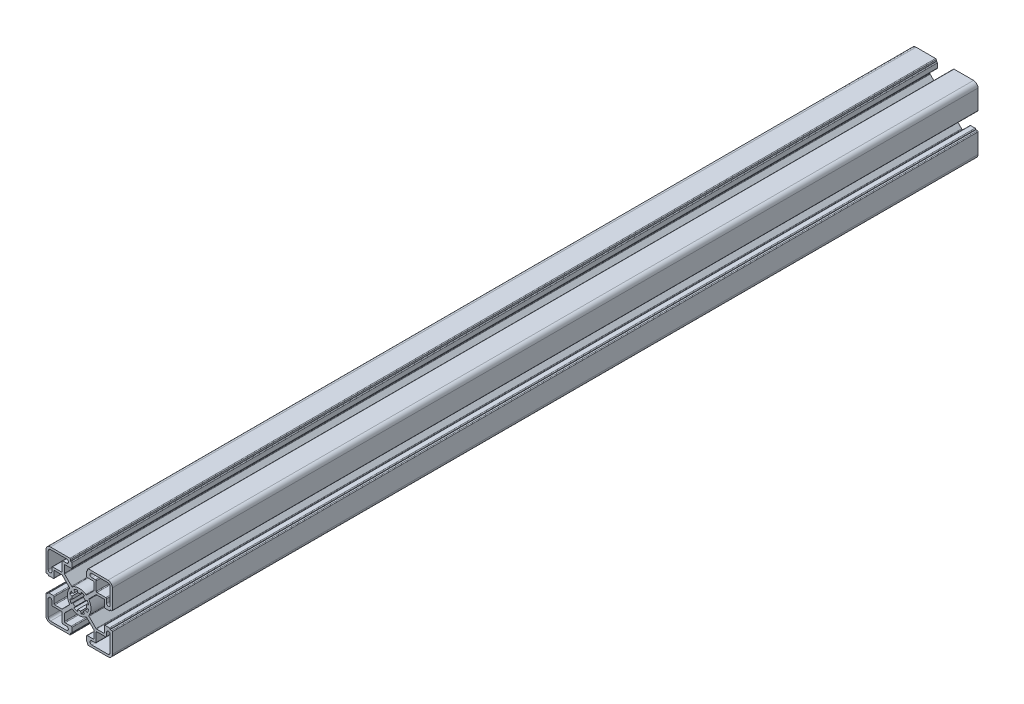
from build123d import *

# Parameters (mm, degrees)
BOSS_EXTRUDE1_DEPTH      = 152.4
BOSS_EXTRUDE1_DEPTH_BACK = 152.4
SKETCH3_R                = 5
FILLET1_R                = 0.5
CUT_EXTRUDE1_DEPTH       = 307.456424309
BOSS_EXTRUDE2_DEPTH      = 282.1


with BuildPart() as part:
    # Sketch3 → Boss-Extrude1 (new, two sides: drawn at the far end of the back side and taken through both)
    with BuildSketch(Plane.XY.offset(-BOSS_EXTRUDE1_DEPTH_BACK)):
        with BuildLine():
            Line((-11.55, -10.05), (-6.356915373, -4.856915373))
            ThreePointArc((-6.356915373, -4.856915373), (-8, 0), (-6.356915373, 4.856915373))
            Line((-6.356915373, 4.856915373), (-11.55, 10.05))
            Line((-11.55, 10.05), (-17.025, 10.05))
            Line((-17.025, 10.05), (-17.025, 5))
            Line((-17.025, 5), (-21, 5))
            Line((-21, 5), (-21, 5.8))
            Line((-21, 5.8), (-22.5, 5.8))
            Line((-22.5, 5.8), (-22.5, 19.5))
            ThreePointArc((-22.5, 19.5), (-21.621320344, 21.621320344), (-19.5, 22.5))
            Line((-19.5, 22.5), (-5.8, 22.5))
            Line((-5.8, 22.5), (-5.8, 21))
            Line((-5.8, 21), (-5, 21))
            Line((-5, 21), (-5, 17.025))
            Line((-5, 17.025), (-10.05, 17.025))
            Line((-10.05, 17.025), (-10.05, 11.55))
            Line((-10.05, 11.55), (-4.856915373, 6.356915373))
            ThreePointArc((-4.856915373, 6.356915373), (0, 8), (4.856915373, 6.356915373))
            Line((4.856915373, 6.356915373), (10.05, 11.55))
            Line((10.05, 11.55), (10.05, 17.025))
            Line((10.05, 17.025), (5, 17.025))
            Line((5, 17.025), (5, 21))
            Line((5, 21), (5.8, 21))
            Line((5.8, 21), (5.8, 22.5))
            Line((5.8, 22.5), (19.5, 22.5))
            ThreePointArc((19.5, 22.5), (21.621320344, 21.621320344), (22.5, 19.5))
            Line((22.5, 19.5), (22.5, 5.8))
            Line((22.5, 5.8), (21, 5.8))
            Line((21, 5.8), (21, 5))
            Line((21, 5), (17.025, 5))
            Line((17.025, 5), (17.025, 10.05))
            Line((17.025, 10.05), (11.55, 10.05))
            Line((11.55, 10.05), (6.356915373, 4.856915373))
            ThreePointArc((6.356915373, 4.856915373), (8, 0), (6.356915373, -4.856915373))
            Line((6.356915373, -4.856915373), (11.55, -10.05))
            Line((11.55, -10.05), (17.025, -10.05))
            Line((17.025, -10.05), (17.025, -5))
            Line((17.025, -5), (21, -5))
            Line((21, -5), (21, -5.8))
            Line((21, -5.8), (22.5, -5.8))
            Line((22.5, -5.8), (22.5, -19.5))
            ThreePointArc((22.5, -19.5), (21.621320344, -21.621320344), (19.5, -22.5))
            Line((19.5, -22.5), (5.8, -22.5))
            Line((5.8, -22.5), (5.8, -21))
            Line((5.8, -21), (5, -21))
            Line((5, -21), (5, -17.025))
            Line((5, -17.025), (10.05, -17.025))
            Line((10.05, -17.025), (10.05, -11.55))
            Line((10.05, -11.55), (4.856915373, -6.356915373))
            ThreePointArc((4.856915373, -6.356915373), (0, -8), (-4.856915373, -6.356915373))
            Line((-4.856915373, -6.356915373), (-10.05, -11.55))
            Line((-10.05, -11.55), (-10.05, -17.025))
            Line((-10.05, -17.025), (-5, -17.025))
            Line((-5, -17.025), (-5, -21))
            Line((-5, -21), (-5.8, -21))
            Line((-5.8, -21), (-5.8, -22.5))
            Line((-5.8, -22.5), (-19.5, -22.5))
            ThreePointArc((-19.5, -22.5), (-21.621320344, -21.621320344), (-22.5, -19.5))
            Line((-22.5, -19.5), (-22.5, -5.8))
            Line((-22.5, -5.8), (-21, -5.8))
            Line((-21, -5.8), (-21, -5))
            Line((-21, -5), (-17.025, -5))
            Line((-17.025, -5), (-17.025, -10.05))
            Line((-17.025, -10.05), (-11.55, -10.05))
        make_face()
        with Locations(Location((0, 0, 0), (0, 0, 180))):
            Circle(SKETCH3_R, mode=Mode.SUBTRACT)
        with BuildLine():
            Line((-21, 8.5375), (-21, 19.5))
            ThreePointArc((-21, 19.5), (-20.560660172, 20.560660172), (-19.5, 21))
            Line((-19.5, 21), (-8.5375, 21))
            ThreePointArc((-8.5375, 21), (-7.3, 19.7625), (-8.5375, 18.525))
            Line((-8.5375, 18.525), (-11.55, 18.525))
            Line((-11.55, 18.525), (-11.55, 11.55))
            Line((-11.55, 11.55), (-18.525, 11.55))
            Line((-18.525, 11.55), (-18.525, 8.5375))
            ThreePointArc((-18.525, 8.5375), (-19.7625, 7.3), (-21, 8.5375))
        make_face(mode=Mode.SUBTRACT)
        with BuildLine():
            Line((8.5375, 21), (19.5, 21))
            ThreePointArc((19.5, 21), (20.560660172, 20.560660172), (21, 19.5))
            Line((21, 19.5), (21, 8.5375))
            ThreePointArc((21, 8.5375), (19.7625, 7.3), (18.525, 8.5375))
            Line((18.525, 8.5375), (18.525, 11.55))
            Line((18.525, 11.55), (11.55, 11.55))
            Line((11.55, 11.55), (11.55, 18.525))
            Line((11.55, 18.525), (8.5375, 18.525))
            ThreePointArc((8.5375, 18.525), (7.3, 19.7625), (8.5375, 21))
        make_face(mode=Mode.SUBTRACT)
        with BuildLine():
            Line((21, -8.5375), (21, -19.5))
            ThreePointArc((21, -19.5), (20.560660172, -20.560660172), (19.5, -21))
            Line((19.5, -21), (8.5375, -21))
            ThreePointArc((8.5375, -21), (7.3, -19.7625), (8.5375, -18.525))
            Line((8.5375, -18.525), (11.55, -18.525))
            Line((11.55, -18.525), (11.55, -11.55))
            Line((11.55, -11.55), (18.525, -11.55))
            Line((18.525, -11.55), (18.525, -8.5375))
            ThreePointArc((18.525, -8.5375), (19.7625, -7.3), (21, -8.5375))
        make_face(mode=Mode.SUBTRACT)
        with BuildLine():
            Line((-8.5375, -21), (-19.5, -21))
            ThreePointArc((-19.5, -21), (-20.560660172, -20.560660172), (-21, -19.5))
            Line((-21, -19.5), (-21, -8.5375))
            ThreePointArc((-21, -8.5375), (-19.7625, -7.3), (-18.525, -8.5375))
            Line((-18.525, -8.5375), (-18.525, -11.55))
            Line((-18.525, -11.55), (-11.55, -11.55))
            Line((-11.55, -11.55), (-11.55, -18.525))
            Line((-11.55, -18.525), (-8.5375, -18.525))
            ThreePointArc((-8.5375, -18.525), (-7.3, -19.7625), (-8.5375, -21))
        make_face(mode=Mode.SUBTRACT)
    extrude(amount=BOSS_EXTRUDE1_DEPTH + BOSS_EXTRUDE1_DEPTH_BACK)

    # Fillet1
    fillet1_edges = [part.edges().sort_by_distance(p)[0] for p in [
        (-11.55, -18.525, 0),
        (-11.55, -11.55, 0),
        (18.525, -11.55, 0),
        (11.55, -11.55, 0),
        (11.55, -18.525, 0),
        (11.55, 18.525, 0),
        (11.55, 11.55, 0),
        (18.525, 11.55, 0),
        (-18.525, 11.55, 0),
        (-11.55, 11.55, 0),
        (-11.55, 18.525, 0),
        (6.356915373, -4.856915373, 0),
        (11.55, -10.05, 0),
        (17.025, -10.05, 0),
        (17.025, -5, 0),
        (21, -5, 0),
        (22.5, -5.8, 0),
        (5.8, -22.5, 0),
        (5, -21, 0),
        (5, -17.025, 0),
        (10.05, -17.025, 0),
        (10.05, -11.55, 0),
        (4.856915373, -6.356915373, 0),
        (-4.856915373, -6.356915373, 0),
        (-10.05, -11.55, 0),
        (-10.05, -17.025, 0),
        (-5, -17.025, 0),
        (-5, -21, 0),
        (-5.8, -22.5, 0),
        (-22.5, -5.8, 0),
        (-21, -5, 0),
        (-17.025, -5, 0),
        (-17.025, -10.05, 0),
        (-11.55, -10.05, 0),
        (-6.356915373, -4.856915373, 0),
        (-6.356915373, 4.856915373, 0),
        (-11.55, 10.05, 0),
        (-17.025, 10.05, 0),
        (-17.025, 5, 0),
        (-21, 5, 0),
        (-22.5, 5.8, 0),
        (-5.8, 22.5, 0),
        (-5, 21, 0),
        (-5, 17.025, 0),
        (-10.05, 17.025, 0),
        (-10.05, 11.55, 0),
        (-4.856915373, 6.356915373, 0),
        (4.856915373, 6.356915373, 0),
        (10.05, 11.55, 0),
        (10.05, 17.025, 0),
        (5, 17.025, 0),
        (5, 21, 0),
        (5.8, 22.5, 0),
        (22.5, 5.8, 0),
        (21, 5, 0),
        (17.025, 5, 0),
        (11.55, 10.05, 0),
        (6.356915373, 4.856915373, 0),
    ]]
    fillet(fillet1_edges, radius=FILLET1_R)

    # Sketch4 → Cut-Extrude1 (cut, through all)
    with BuildSketch(Plane.XY.offset(152.4)):
        with BuildLine():
            Line((-1.268087093, 6.375104323), (-0.97545161, 4.903926402))
            ThreePointArc((-0.97545161, 4.903926402), (-1.913417162, 4.619397663), (-2.777851165, 4.157348062))
            Line((-2.777851165, 4.157348062), (-3.611206515, 5.40455248))
            ThreePointArc((-3.611206515, 5.40455248), (-2.48744231, 6.005216961), (-1.268087093, 6.375104323))
        make_face()
        with BuildLine():
            Line((1.268087093, 6.375104323), (0.97545161, 4.903926402))
            ThreePointArc((0.97545161, 4.903926402), (1.913417162, 4.619397663), (2.777851165, 4.157348062))
            Line((2.777851165, 4.157348062), (3.611206515, 5.40455248))
            ThreePointArc((3.611206515, 5.40455248), (2.48744231, 6.005216961), (1.268087093, 6.375104323))
        make_face()
        with BuildLine():
            Line((5.40455248, 3.611206515), (4.157348062, 2.777851165))
            ThreePointArc((4.157348062, 2.777851165), (4.619397663, 1.913417162), (4.903926402, 0.97545161))
            Line((4.903926402, 0.97545161), (6.375104323, 1.268087093))
            ThreePointArc((6.375104323, 1.268087093), (6.005216961, 2.48744231), (5.40455248, 3.611206515))
        make_face()
        with BuildLine():
            Line((6.375104323, -1.268087093), (4.903926402, -0.97545161))
            ThreePointArc((4.903926402, -0.97545161), (4.619397663, -1.913417162), (4.157348062, -2.777851165))
            Line((4.157348062, -2.777851165), (5.40455248, -3.611206515))
            ThreePointArc((5.40455248, -3.611206515), (6.005216961, -2.48744231), (6.375104323, -1.268087093))
        make_face()
        with BuildLine():
            Line((3.611206515, -5.40455248), (2.777851165, -4.157348062))
            ThreePointArc((2.777851165, -4.157348062), (1.913417162, -4.619397663), (0.97545161, -4.903926402))
            Line((0.97545161, -4.903926402), (1.268087093, -6.375104323))
            ThreePointArc((1.268087093, -6.375104323), (2.48744231, -6.005216961), (3.611206515, -5.40455248))
        make_face()
        with BuildLine():
            Line((-1.268087093, -6.375104323), (-0.97545161, -4.903926402))
            ThreePointArc((-0.97545161, -4.903926402), (-1.913417162, -4.619397663), (-2.777851165, -4.157348062))
            Line((-2.777851165, -4.157348062), (-3.611206515, -5.40455248))
            ThreePointArc((-3.611206515, -5.40455248), (-2.48744231, -6.005216961), (-1.268087093, -6.375104323))
        make_face()
        with BuildLine():
            Line((-5.40455248, -3.611206515), (-4.157348062, -2.777851165))
            ThreePointArc((-4.157348062, -2.777851165), (-4.619397663, -1.913417162), (-4.903926402, -0.97545161))
            Line((-4.903926402, -0.97545161), (-6.375104323, -1.268087093))
            ThreePointArc((-6.375104323, -1.268087093), (-6.005216961, -2.48744231), (-5.40455248, -3.611206515))
        make_face()
        with BuildLine():
            Line((-6.375104323, 1.268087093), (-4.903926402, 0.97545161))
            ThreePointArc((-4.903926402, 0.97545161), (-4.619397663, 1.913417162), (-4.157348062, 2.777851165))
            Line((-4.157348062, 2.777851165), (-5.40455248, 3.611206515))
            ThreePointArc((-5.40455248, 3.611206515), (-6.005216961, 2.48744231), (-6.375104323, 1.268087093))
        make_face()
    extrude(amount=-CUT_EXTRUDE1_DEPTH, mode=Mode.SUBTRACT)

    # Sketch6 → Boss-Extrude2 (add)
    with BuildSketch(Plane.XY.offset(152.4)):
        with BuildLine():
            Line((22.5, -19.5), (22.5, -6.3))
            ThreePointArc((22.5, -6.3), (22.353553391, -5.946446609), (22, -5.8))
            Line((22, -5.8), (21, -5.8))
            Line((21, -5.8), (21, -5.5))
            ThreePointArc((21, -5.5), (20.853553391, -5.146446609), (20.5, -5))
            Line((20.5, -5), (17.525, -5))
            ThreePointArc((17.525, -5), (17.171446609, -5.146446609), (17.025, -5.5))
            Line((17.025, -5.5), (17.025, -9.55))
            ThreePointArc((17.025, -9.55), (16.878553391, -9.903553391), (16.525, -10.05))
            Line((16.525, -10.05), (11.757106781, -10.05))
            ThreePointArc((11.757106781, -10.05), (11.565765065, -10.011939766), (11.403553391, -9.903553391))
            Line((11.403553391, -9.903553391), (6.658229, -5.158229))
            ThreePointArc((6.658229, -5.158229), (6.513911961, -4.850773717), (6.599324603, -4.522047632))
            ThreePointArc((6.599324603, -4.522047632), (8, 0), (6.599324603, 4.522047632))
            ThreePointArc((6.599324603, 4.522047632), (6.513911961, 4.850773717), (6.658229, 5.158229))
            Line((6.658229, 5.158229), (11.403553391, 9.903553391))
            ThreePointArc((11.403553391, 9.903553391), (11.565765065, 10.011939766), (11.757106781, 10.05))
            Line((11.757106781, 10.05), (17.025, 10.05))
            Line((17.025, 10.05), (17.025, 5.5))
            ThreePointArc((17.025, 5.5), (17.171446609, 5.146446609), (17.525, 5))
            Line((17.525, 5), (20.5, 5))
            ThreePointArc((20.5, 5), (20.853553391, 5.146446609), (21, 5.5))
            Line((21, 5.5), (21, 5.8))
            Line((21, 5.8), (22, 5.8))
            ThreePointArc((22, 5.8), (22.353553391, 5.946446609), (22.5, 6.3))
            Line((22.5, 6.3), (22.5, 19.5))
            ThreePointArc((22.5, 19.5), (21.621320344, 21.621320344), (19.5, 22.5))
            Line((19.5, 22.5), (6.3, 22.5))
            ThreePointArc((6.3, 22.5), (5.946446609, 22.353553391), (5.8, 22))
            Line((5.8, 22), (5.8, 21))
            Line((5.8, 21), (5.5, 21))
            ThreePointArc((5.5, 21), (5.146446609, 20.853553391), (5, 20.5))
            Line((5, 20.5), (5, 17.525))
            ThreePointArc((5, 17.525), (5.146446609, 17.171446609), (5.5, 17.025))
            Line((5.5, 17.025), (9.55, 17.025))
            ThreePointArc((9.55, 17.025), (9.903553391, 16.878553391), (10.05, 16.525))
            Line((10.05, 16.525), (10.05, 11.757106781))
            ThreePointArc((10.05, 11.757106781), (10.011939766, 11.565765065), (9.903553391, 11.403553391))
            Line((9.903553391, 11.403553391), (5.158229, 6.658229))
            ThreePointArc((5.158229, 6.658229), (4.850773717, 6.513911961), (4.522047632, 6.599324603))
            ThreePointArc((4.522047632, 6.599324603), (0, 8), (-4.522047632, 6.599324603))
            ThreePointArc((-4.522047632, 6.599324603), (-4.850773717, 6.513911961), (-5.158229, 6.658229))
            Line((-5.158229, 6.658229), (-9.903553391, 11.403553391))
            ThreePointArc((-9.903553391, 11.403553391), (-10.011939766, 11.565765065), (-10.05, 11.757106781))
            Line((-10.05, 11.757106781), (-10.05, 16.525))
            ThreePointArc((-10.05, 16.525), (-9.903553391, 16.878553391), (-9.55, 17.025))
            Line((-9.55, 17.025), (-5.5, 17.025))
            ThreePointArc((-5.5, 17.025), (-5.146446609, 17.171446609), (-5, 17.525))
            Line((-5, 17.525), (-5, 20.5))
            ThreePointArc((-5, 20.5), (-5.146446609, 20.853553391), (-5.5, 21))
            Line((-5.5, 21), (-5.8, 21))
            Line((-5.8, 21), (-5.8, 22))
            ThreePointArc((-5.8, 22), (-5.946446609, 22.353553391), (-6.3, 22.5))
            Line((-6.3, 22.5), (-19.5, 22.5))
            ThreePointArc((-19.5, 22.5), (-21.621320344, 21.621320344), (-22.5, 19.5))
            Line((-22.5, 19.5), (-22.5, 6.3))
            ThreePointArc((-22.5, 6.3), (-22.353553391, 5.946446609), (-22, 5.8))
            Line((-22, 5.8), (-21, 5.8))
            Line((-21, 5.8), (-21, 5.5))
            ThreePointArc((-21, 5.5), (-20.853553391, 5.146446609), (-20.5, 5))
            Line((-20.5, 5), (-17.525, 5))
            ThreePointArc((-17.525, 5), (-17.171446609, 5.146446609), (-17.025, 5.5))
            Line((-17.025, 5.5), (-17.025, 9.55))
            ThreePointArc((-17.025, 9.55), (-16.878553391, 9.903553391), (-16.525, 10.05))
            Line((-16.525, 10.05), (-11.757106781, 10.05))
            ThreePointArc((-11.757106781, 10.05), (-11.565765065, 10.011939766), (-11.403553391, 9.903553391))
            Line((-11.403553391, 9.903553391), (-6.658229, 5.158229))
            ThreePointArc((-6.658229, 5.158229), (-6.513911961, 4.850773717), (-6.599324603, 4.522047632))
            ThreePointArc((-6.599324603, 4.522047632), (-8, 0), (-6.599324603, -4.522047632))
            ThreePointArc((-6.599324603, -4.522047632), (-6.513911961, -4.850773717), (-6.658229, -5.158229))
            Line((-6.658229, -5.158229), (-11.403553391, -9.903553391))
            ThreePointArc((-11.403553391, -9.903553391), (-11.565765065, -10.011939766), (-11.757106781, -10.05))
            Line((-11.757106781, -10.05), (-16.525, -10.05))
            ThreePointArc((-16.525, -10.05), (-16.878553391, -9.903553391), (-17.025, -9.55))
            Line((-17.025, -9.55), (-17.025, -5.5))
            ThreePointArc((-17.025, -5.5), (-17.171446609, -5.146446609), (-17.525, -5))
            Line((-17.525, -5), (-20.5, -5))
            ThreePointArc((-20.5, -5), (-20.853553391, -5.146446609), (-21, -5.5))
            Line((-21, -5.5), (-21, -5.8))
            Line((-21, -5.8), (-22, -5.8))
            ThreePointArc((-22, -5.8), (-22.353553391, -5.946446609), (-22.5, -6.3))
            Line((-22.5, -6.3), (-22.5, -19.5))
            ThreePointArc((-22.5, -19.5), (-21.621320344, -21.621320344), (-19.5, -22.5))
            Line((-19.5, -22.5), (-6.3, -22.5))
            ThreePointArc((-6.3, -22.5), (-5.946446609, -22.353553391), (-5.8, -22))
            Line((-5.8, -22), (-5.8, -21))
            Line((-5.8, -21), (-5.5, -21))
            ThreePointArc((-5.5, -21), (-5.146446609, -20.853553391), (-5, -20.5))
            Line((-5, -20.5), (-5, -17.525))
            ThreePointArc((-5, -17.525), (-5.146446609, -17.171446609), (-5.5, -17.025))
            Line((-5.5, -17.025), (-9.55, -17.025))
            ThreePointArc((-9.55, -17.025), (-9.903553391, -16.878553391), (-10.05, -16.525))
            Line((-10.05, -16.525), (-10.05, -11.757106781))
            ThreePointArc((-10.05, -11.757106781), (-10.011939766, -11.565765065), (-9.903553391, -11.403553391))
            Line((-9.903553391, -11.403553391), (-5.158229, -6.658229))
            ThreePointArc((-5.158229, -6.658229), (-4.850773717, -6.513911961), (-4.522047632, -6.599324603))
            ThreePointArc((-4.522047632, -6.599324603), (0, -8), (4.522047632, -6.599324603))
            ThreePointArc((4.522047632, -6.599324603), (4.850773717, -6.513911961), (5.158229, -6.658229))
            Line((5.158229, -6.658229), (9.903553391, -11.403553391))
            ThreePointArc((9.903553391, -11.403553391), (10.011939766, -11.565765065), (10.05, -11.757106781))
            Line((10.05, -11.757106781), (10.05, -16.525))
            ThreePointArc((10.05, -16.525), (9.903553391, -16.878553391), (9.55, -17.025))
            Line((9.55, -17.025), (5.5, -17.025))
            ThreePointArc((5.5, -17.025), (5.146446609, -17.171446609), (5, -17.525))
            Line((5, -17.525), (5, -20.5))
            ThreePointArc((5, -20.5), (5.146446609, -20.853553391), (5.5, -21))
            Line((5.5, -21), (5.8, -21))
            Line((5.8, -21), (5.8, -22))
            ThreePointArc((5.8, -22), (5.946446609, -22.353553391), (6.3, -22.5))
            Line((6.3, -22.5), (19.5, -22.5))
            ThreePointArc((19.5, -22.5), (21.621320344, -21.621320344), (22.5, -19.5))
        make_face()
        with BuildLine():
            Line((-11.55, -18.025), (-11.55, -12.05))
            ThreePointArc((-11.55, -12.05), (-11.696446609, -11.696446609), (-12.05, -11.55))
            Line((-12.05, -11.55), (-18.525, -11.55))
            Line((-18.525, -11.55), (-18.525, -8.5375))
            ThreePointArc((-18.525, -8.5375), (-19.7625, -7.3), (-21, -8.5375))
            Line((-21, -8.5375), (-21, -19.5))
            ThreePointArc((-21, -19.5), (-20.560660172, -20.560660172), (-19.5, -21))
            Line((-19.5, -21), (-8.5375, -21))
            ThreePointArc((-8.5375, -21), (-7.3, -19.7625), (-8.5375, -18.525))
            Line((-8.5375, -18.525), (-11.05, -18.525))
            ThreePointArc((-11.05, -18.525), (-11.403553391, -18.378553391), (-11.55, -18.025))
        make_face(mode=Mode.SUBTRACT)
        with BuildLine():
            Line((-0.97545161, 4.903926402), (-1.268087093, 6.375104323))
            ThreePointArc((-1.268087093, 6.375104323), (-2.48744231, 6.005216961), (-3.611206515, 5.40455248))
            Line((-3.611206515, 5.40455248), (-2.777851165, 4.157348062))
            ThreePointArc((-2.777851165, 4.157348062), (-3.535533906, 3.535533906), (-4.157348062, 2.777851165))
            Line((-4.157348062, 2.777851165), (-5.40455248, 3.611206515))
            ThreePointArc((-5.40455248, 3.611206515), (-6.005216961, 2.48744231), (-6.375104323, 1.268087093))
            Line((-6.375104323, 1.268087093), (-4.903926402, 0.97545161))
            ThreePointArc((-4.903926402, 0.97545161), (-5, 0), (-4.903926402, -0.97545161))
            Line((-4.903926402, -0.97545161), (-6.375104323, -1.268087093))
            ThreePointArc((-6.375104323, -1.268087093), (-6.005216961, -2.48744231), (-5.40455248, -3.611206515))
            Line((-5.40455248, -3.611206515), (-4.157348062, -2.777851165))
            ThreePointArc((-4.157348062, -2.777851165), (-3.535533906, -3.535533906), (-2.777851165, -4.157348062))
            Line((-2.777851165, -4.157348062), (-3.611206515, -5.40455248))
            ThreePointArc((-3.611206515, -5.40455248), (-2.48744231, -6.005216961), (-1.268087093, -6.375104323))
            Line((-1.268087093, -6.375104323), (-0.97545161, -4.903926402))
            ThreePointArc((-0.97545161, -4.903926402), (0, -5), (0.97545161, -4.903926402))
            Line((0.97545161, -4.903926402), (1.268087093, -6.375104323))
            ThreePointArc((1.268087093, -6.375104323), (2.48744231, -6.005216961), (3.611206515, -5.40455248))
            Line((3.611206515, -5.40455248), (2.777851165, -4.157348062))
            ThreePointArc((2.777851165, -4.157348062), (3.535533906, -3.535533906), (4.157348062, -2.777851165))
            Line((4.157348062, -2.777851165), (5.40455248, -3.611206515))
            ThreePointArc((5.40455248, -3.611206515), (6.005216961, -2.48744231), (6.375104323, -1.268087093))
            Line((6.375104323, -1.268087093), (4.903926402, -0.97545161))
            ThreePointArc((4.903926402, -0.97545161), (5, 0), (4.903926402, 0.97545161))
            Line((4.903926402, 0.97545161), (6.375104323, 1.268087093))
            ThreePointArc((6.375104323, 1.268087093), (6.005216961, 2.48744231), (5.40455248, 3.611206515))
            Line((5.40455248, 3.611206515), (4.157348062, 2.777851165))
            ThreePointArc((4.157348062, 2.777851165), (3.535533906, 3.535533906), (2.777851165, 4.157348062))
            Line((2.777851165, 4.157348062), (3.611206515, 5.40455248))
            ThreePointArc((3.611206515, 5.40455248), (2.48744231, 6.005216961), (1.268087093, 6.375104323))
            Line((1.268087093, 6.375104323), (0.97545161, 4.903926402))
            ThreePointArc((0.97545161, 4.903926402), (0, 5), (-0.97545161, 4.903926402))
        make_face(mode=Mode.SUBTRACT)
        with BuildLine():
            Line((18.025, -11.55), (12.05, -11.55))
            ThreePointArc((12.05, -11.55), (11.696446609, -11.696446609), (11.55, -12.05))
            Line((11.55, -12.05), (11.55, -18.025))
            ThreePointArc((11.55, -18.025), (11.403553391, -18.378553391), (11.05, -18.525))
            Line((11.05, -18.525), (8.5375, -18.525))
            ThreePointArc((8.5375, -18.525), (7.3, -19.7625), (8.5375, -21))
            Line((8.5375, -21), (19.5, -21))
            ThreePointArc((19.5, -21), (20.560660172, -20.560660172), (21, -19.5))
            Line((21, -19.5), (21, -8.5375))
            ThreePointArc((21, -8.5375), (19.7625, -7.3), (18.525, -8.5375))
            Line((18.525, -8.5375), (18.525, -11.05))
            ThreePointArc((18.525, -11.05), (18.378553391, -11.403553391), (18.025, -11.55))
        make_face(mode=Mode.SUBTRACT)
        with BuildLine():
            Line((11.55, 18.025), (11.55, 12.05))
            ThreePointArc((11.55, 12.05), (11.696446609, 11.696446609), (12.05, 11.55))
            Line((12.05, 11.55), (18.025, 11.55))
            ThreePointArc((18.025, 11.55), (18.378553391, 11.403553391), (18.525, 11.05))
            Line((18.525, 11.05), (18.525, 8.5375))
            ThreePointArc((18.525, 8.5375), (19.7625, 7.3), (21, 8.5375))
            Line((21, 8.5375), (21, 19.5))
            ThreePointArc((21, 19.5), (20.560660172, 20.560660172), (19.5, 21))
            Line((19.5, 21), (8.5375, 21))
            ThreePointArc((8.5375, 21), (7.3, 19.7625), (8.5375, 18.525))
            Line((8.5375, 18.525), (11.05, 18.525))
            ThreePointArc((11.05, 18.525), (11.403553391, 18.378553391), (11.55, 18.025))
        make_face(mode=Mode.SUBTRACT)
        with BuildLine():
            Line((-18.025, 11.55), (-12.05, 11.55))
            ThreePointArc((-12.05, 11.55), (-11.696446609, 11.696446609), (-11.55, 12.05))
            Line((-11.55, 12.05), (-11.55, 18.025))
            ThreePointArc((-11.55, 18.025), (-11.403553391, 18.378553391), (-11.05, 18.525))
            Line((-11.05, 18.525), (-8.5375, 18.525))
            ThreePointArc((-8.5375, 18.525), (-7.3, 19.7625), (-8.5375, 21))
            Line((-8.5375, 21), (-19.5, 21))
            ThreePointArc((-19.5, 21), (-20.560660172, 20.560660172), (-21, 19.5))
            Line((-21, 19.5), (-21, 8.5375))
            ThreePointArc((-21, 8.5375), (-19.7625, 7.3), (-18.525, 8.5375))
            Line((-18.525, 8.5375), (-18.525, 11.05))
            ThreePointArc((-18.525, 11.05), (-18.378553391, 11.403553391), (-18.025, 11.55))
        make_face(mode=Mode.SUBTRACT)
    extrude(amount=BOSS_EXTRUDE2_DEPTH)


solid = part.part
